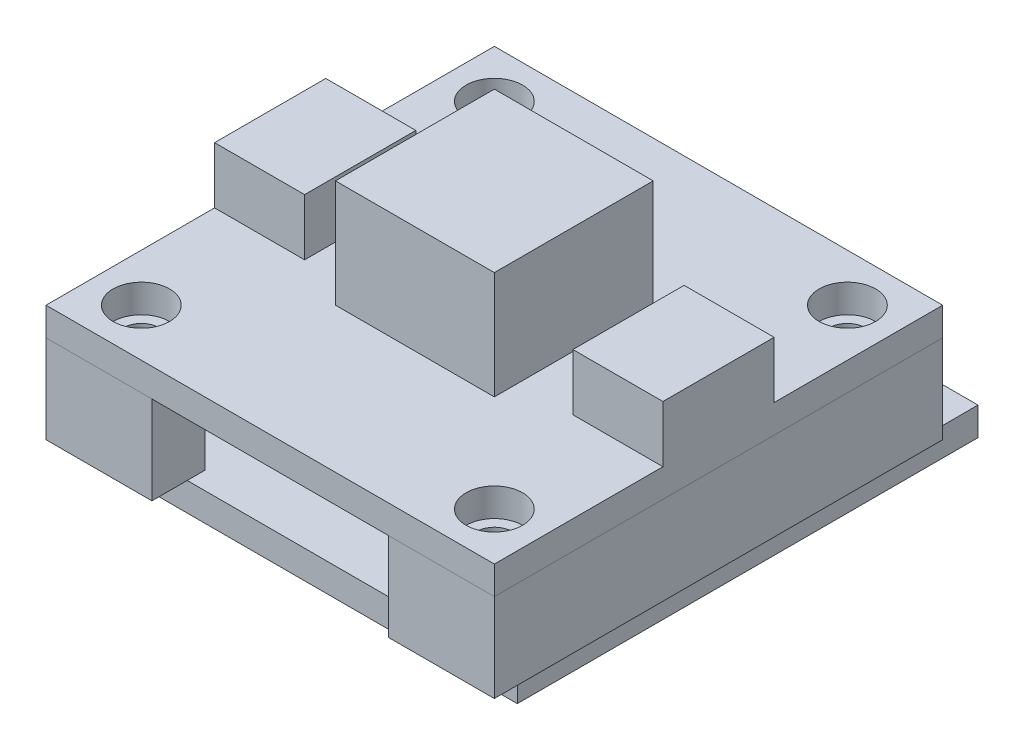
from build123d import *

# Parameters (mm, degrees)
SKETCH1_W            = 25.4
SKETCH1_H            = 25.4
SKETCH1_R            = 1.6
BOSS_EXTRUDE1_DEPTH  = 1.6
SKETCH2_W            = 9
SKETCH2_H            = 9
BOSS_EXTRUDE2_DEPTH  = 6.1
SKETCH3_W            = 5.1
SKETCH3_H            = 6.3
BOSS_EXTRUDE3_DEPTH  = 3.2
SKETCH4_W            = 24
SKETCH4_H            = 26.1
BOSS_EXTRUDE4_DEPTH  = 1.6
SKETCH5_R            = 1.6
CUT_EXTRUDE1_DEPTH   = 1.6
SKETCH6_W            = 10.4
SKETCH6_H            = 6.2
BOSS_EXTRUDE5_DEPTH  = 2.2
SKETCH7_R            = 1.6
SKETCH7_W            = 13.4
SKETCH7_H            = 3
BOSS_EXTRUDE6_DEPTH  = 1
SKETCH8_R            = 1.6
SKETCH8_R_2          = 2.1
SKETCH8_W            = 13.4
SKETCH8_H            = 9.4
BOSS_EXTRUDE7_DEPTH  = 4
SKETCH9_R            = 1.6
SKETCH9_R_2          = 1
BOSS_EXTRUDE8_DEPTH  = 1
SKETCH10_R           = 1.6
SKETCH10_R_2         = 1
BOSS_EXTRUDE9_DEPTH  = 4
SKETCH11_R           = 2.1
SKETCH11_R_2         = 1
CUT_EXTRUDE2_DEPTH   = 2
SKETCH12_R           = 1
BOSS_EXTRUDE10_DEPTH = 0.3
SKETCH13_W           = 13.4
SKETCH13_H           = 15.4
CUT_EXTRUDE3_DEPTH   = 2
CUT_EXTRUDE4_DEPTH   = 11


with BuildPart() as part:
    # Sketch1 → Boss-Extrude1 (new body)
    with BuildSketch(Plane(origin=(0, 0, 0), x_dir=(1, 0, 0), z_dir=(0, 1, 0))):
        Rectangle(SKETCH1_W, SKETCH1_H)
        with Locations(Location((-10, 10, 0), (0, 0, 270))):
            Circle(SKETCH1_R, mode=Mode.SUBTRACT)
        with Locations(Location((10, 10, 0), (0, 0, 270))):
            Circle(SKETCH1_R, mode=Mode.SUBTRACT)
        with Locations(Location((10, -10, 0), (0, 0, 270))):
            Circle(SKETCH1_R, mode=Mode.SUBTRACT)
        with Locations(Location((-10, -10, 0), (0, 0, 270))):
            Circle(SKETCH1_R, mode=Mode.SUBTRACT)
    extrude(amount=BOSS_EXTRUDE1_DEPTH)

    # Sketch2 → Boss-Extrude2 (add)
    with BuildSketch(Plane(origin=(0, 1.6, 0), x_dir=(1, 0, 0), z_dir=(0, 1, 0))):
        Rectangle(SKETCH2_W, SKETCH2_H)
    extrude(amount=BOSS_EXTRUDE2_DEPTH)

    # Sketch3 → Boss-Extrude3 (add)
    with BuildSketch(Plane(origin=(0, 1.6, 0), x_dir=(1, 0, 0), z_dir=(0, 1, 0))):
        with Locations((-10.15, 0)):
            Rectangle(SKETCH3_W, SKETCH3_H)
        with Locations((10.15, 0)):
            Rectangle(SKETCH3_W, SKETCH3_H)
    extrude(amount=BOSS_EXTRUDE3_DEPTH)


with BuildPart() as body_2:
    # Sketch4 → Boss-Extrude4 (new body)
    with BuildSketch(Plane(origin=(0, -5, 0), x_dir=(-1, 0, 0), z_dir=(0, -1, 0))):
        with Locations((0, 2.35)):
            Rectangle(SKETCH4_W, SKETCH4_H)
    extrude(amount=BOSS_EXTRUDE4_DEPTH)

    # Sketch5 → Cut-Extrude1 (cut)
    with BuildSketch(Plane.XZ.offset(6.6)):
        with Locations(Location((-9, -5.9, 0), (0, 0, 270))):
            Circle(SKETCH5_R)
        with Locations(Location((9, -5.9, 0), (0, 0, 270))):
            Circle(SKETCH5_R)
    extrude(amount=-CUT_EXTRUDE1_DEPTH, mode=Mode.SUBTRACT)

    # Sketch6 → Boss-Extrude5 (add)
    with BuildSketch(Plane.XZ.offset(6.6)):
        with Locations((0, -12.3)):
            Rectangle(SKETCH6_W, SKETCH6_H)
    extrude(amount=BOSS_EXTRUDE5_DEPTH)


with BuildPart() as body_3:
    # Sketch7 → Boss-Extrude6 (new body)
    # profile 1 of 4: a face of its own
    with BuildSketch(Plane.XZ):
        Polygon((12.7, 12.7), (6.7, 12.7), (6.7, 7.7), (6.7, 4.7), (6.7, -4.7), (6.7, -7.7), (6.7, -12.7), (12.7, -12.7), align=None)
        with Locations(Location((10, -10, 0), (0, 0, 270))):
            Circle(SKETCH7_R, mode=Mode.SUBTRACT)
        with Locations(Location((10, 10, 0), (0, 0, 270))):
            Circle(SKETCH7_R, mode=Mode.SUBTRACT)
    # profile 2 of 4: a face of its own
    with BuildSketch(Plane.XZ):
        with Locations((0, 6.2)):
            Rectangle(SKETCH7_W, SKETCH7_H)
    # profile 3 of 4: a face of its own
    with BuildSketch(Plane.XZ):
        with Locations((0, -6.2)):
            Rectangle(SKETCH7_W, SKETCH7_H)
    # profile 4 of 4: a face of its own
    with BuildSketch(Plane.XZ):
        Polygon((-6.7, 12.7), (-12.7, 12.7), (-12.7, -12.7), (-6.7, -12.7), (-6.7, -7.7), (-6.7, -4.7), (-6.7, 4.7), (-6.7, 7.7), align=None)
        with Locations(Location((-10, -10, 0), (0, 0, 270))):
            Circle(SKETCH7_R, mode=Mode.SUBTRACT)
        with Locations(Location((-10, 10, 0), (0, 0, 270))):
            Circle(SKETCH7_R, mode=Mode.SUBTRACT)
    extrude(amount=BOSS_EXTRUDE6_DEPTH)

    # Sketch8 → Boss-Extrude7 (add)
    with BuildSketch(Plane.XZ.offset(1)):
        Polygon((12.7, 12.7), (6.7, 12.7), (6.7, 7.7), (-6.7, 7.7), (-6.7, 12.7), (-12.7, 12.7), (-12.7, -12.7), (-6.7, -12.7), (-6.7, -7.7), (6.7, -7.7), (6.7, -12.7), (12.7, -12.7), align=None)
        with Locations(Location((9, -5.9, 0), (0, 0, 90))):
            Circle(SKETCH8_R, mode=Mode.SUBTRACT)
        with Locations(Location((-9, -5.9, 0), (0, 0, 90))):
            Circle(SKETCH8_R, mode=Mode.SUBTRACT)
        with Locations(Location((-10, 10, 0), (0, 0, 90))):
            Circle(SKETCH8_R_2, mode=Mode.SUBTRACT)
        with Locations(Location((10, 10, 0), (0, 0, 90))):
            Circle(SKETCH8_R_2, mode=Mode.SUBTRACT)
        with Locations(Location((-10, -10, 0), (0, 0, 90))):
            Circle(SKETCH8_R_2, mode=Mode.SUBTRACT)
        with Locations(Location((10, -10, 0), (0, 0, 90))):
            Circle(SKETCH8_R_2, mode=Mode.SUBTRACT)
        Rectangle(SKETCH8_W, SKETCH8_H, mode=Mode.SUBTRACT)
    extrude(amount=BOSS_EXTRUDE7_DEPTH)

    # Sketch9 → Boss-Extrude8 (add)
    # profile 1 of 4: a face of its own
    with BuildSketch(Plane.XZ.offset(1)):
        with Locations(Location((-10, 10, 0), (0, 0, 90))):
            Circle(SKETCH9_R)
        with Locations(Location((-10, 10, 0), (0, 0, 270))):
            Circle(SKETCH9_R_2, mode=Mode.SUBTRACT)
    # profile 2 of 4: a face of its own
    with BuildSketch(Plane.XZ.offset(1)):
        with Locations(Location((10, 10, 0), (0, 0, 90))):
            Circle(SKETCH9_R)
        with Locations(Location((10, 10, 0), (0, 0, 270))):
            Circle(SKETCH9_R_2, mode=Mode.SUBTRACT)
    # profile 3 of 4: a face of its own
    with BuildSketch(Plane.XZ.offset(1)):
        with Locations(Location((-10, -10, 0), (0, 0, 90))):
            Circle(SKETCH9_R)
        with Locations(Location((-10, -10, 0), (0, 0, 270))):
            Circle(SKETCH9_R_2, mode=Mode.SUBTRACT)
    # profile 4 of 4: a face of its own
    with BuildSketch(Plane.XZ.offset(1)):
        with Locations(Location((10, -10, 0), (0, 0, 90))):
            Circle(SKETCH9_R)
        with Locations(Location((10, -10, 0), (0, 0, 270))):
            Circle(SKETCH9_R_2, mode=Mode.SUBTRACT)
    extrude(amount=-BOSS_EXTRUDE8_DEPTH)

    # Sketch10 → Boss-Extrude9 (add)
    # profile 1 of 2: a face of its own
    with BuildSketch(Plane.XZ.offset(5)):
        with Locations(Location((-9, -5.9, 0), (0, 0, 270))):
            Circle(SKETCH10_R)
        with Locations(Location((-9, -5.9, 0), (0, 0, 270))):
            Circle(SKETCH10_R_2, mode=Mode.SUBTRACT)
    # profile 2 of 2: a face of its own
    with BuildSketch(Plane.XZ.offset(5)):
        with Locations(Location((9, -5.9, 0), (0, 0, 270))):
            Circle(SKETCH10_R)
        with Locations(Location((9, -5.9, 0), (0, 0, 270))):
            Circle(SKETCH10_R_2, mode=Mode.SUBTRACT)
    extrude(amount=-BOSS_EXTRUDE9_DEPTH)

    # Sketch11 → Cut-Extrude2 (cut)
    # profile 1 of 4: a face of its own
    with BuildSketch(Plane(origin=(0, 0, 0), x_dir=(1, 0, 0), z_dir=(0, 1, 0))):
        with Locations(Location((-9, 5.9, 0), (0, 0, 270))):
            Circle(SKETCH11_R)
        with Locations(Location((-9, 5.9, 0), (0, 0, 90))):
            Circle(SKETCH11_R_2, mode=Mode.SUBTRACT)
    # profile 2 of 4: a face of its own
    with BuildSketch(Plane(origin=(0, 0, 0), x_dir=(1, 0, 0), z_dir=(0, 1, 0))):
        with Locations(Location((-9, 5.9, 0), (0, 0, 90))):
            Circle(SKETCH11_R_2)
    # profile 3 of 4: a face of its own
    with BuildSketch(Plane(origin=(0, 0, 0), x_dir=(1, 0, 0), z_dir=(0, 1, 0))):
        with Locations(Location((9, 5.9, 0), (0, 0, 270))):
            Circle(SKETCH11_R)
        with Locations(Location((9, 5.9, 0), (0, 0, 90))):
            Circle(SKETCH11_R_2, mode=Mode.SUBTRACT)
    # profile 4 of 4: a face of its own
    with BuildSketch(Plane(origin=(0, 0, 0), x_dir=(1, 0, 0), z_dir=(0, 1, 0))):
        with Locations(Location((9, 5.9, 0), (0, 0, 90))):
            Circle(SKETCH11_R_2)
    extrude(amount=-CUT_EXTRUDE2_DEPTH, mode=Mode.SUBTRACT)

    # Sketch12 → Boss-Extrude10 (add)
    with BuildSketch(Plane(origin=(0, -2, 0), x_dir=(1, 0, 0), z_dir=(0, 1, 0))):
        with Locations(Location((-9, 5.9, 0), (0, 0, 90))):
            Circle(SKETCH12_R)
        with Locations(Location((9, 5.9, 0), (0, 0, 90))):
            Circle(SKETCH12_R)
    extrude(amount=-BOSS_EXTRUDE10_DEPTH)

    # Sketch13 → Cut-Extrude3 (cut)
    with BuildSketch(Plane.XZ.offset(5)):
        Rectangle(SKETCH13_W, SKETCH13_H)
    extrude(amount=-CUT_EXTRUDE3_DEPTH, mode=Mode.SUBTRACT)

    # Sketch14 → Cut-Extrude4 (cut)
    with BuildSketch(Plane.XZ.offset(3)):
        with BuildLine():
            Line((-6.5, 9.7), (6.5, 9.7))
            ThreePointArc((6.5, 9.7), (10, 6.2), (6.5, 2.7))
            Line((6.5, 2.7), (-6.5, 2.7))
            ThreePointArc((-6.5, 2.7), (-10, 6.2), (-6.5, 9.7))
        make_face()
    extrude(amount=CUT_EXTRUDE4_DEPTH, mode=Mode.SUBTRACT)


solid = Compound([part.part, body_2.part, body_3.part])
